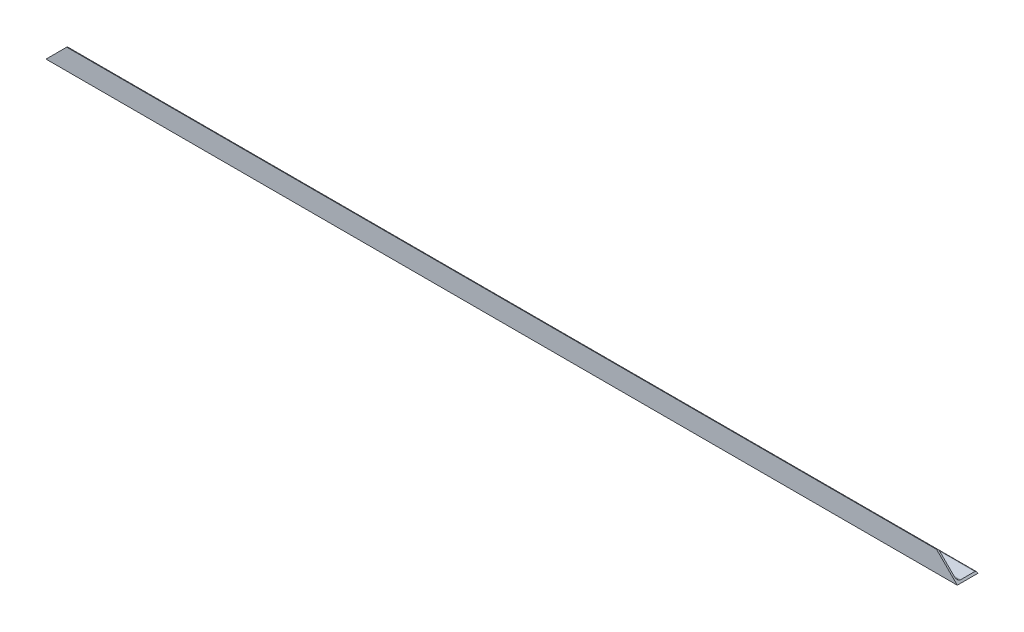
from build123d import *

# Parameters (mm, degrees)
L_ANGLE_EQUAL_40X40X3_7_DEPTH = 1760
CUT_EXTRUDE1_DEPTH            = 1761.908856244


with BuildPart() as part:
    # Sketch13 → L angle (equal) 40X40X3(7) (new body)
    with BuildSketch(Plane(origin=(0, 0, 0), x_dir=(0, 0, -1), z_dir=(1, 0, 0))):
        with BuildLine():
            Line((0, 40), (0, 0))
            Line((0, 0), (40, 0))
            ThreePointArc((40, 0), (39.121320344, 2.121320344), (37, 3))
            Line((37, 3), (9, 3))
            ThreePointArc((9, 3), (4.757359313, 4.757359313), (3, 9))
            Line((3, 9), (3, 37))
            ThreePointArc((3, 37), (2.121320344, 39.121320344), (0, 40))
        make_face()
    extrude(amount=L_ANGLE_EQUAL_40X40X3_7_DEPTH)

    # Sketch14 → Cut-Extrude1 (cut, through all)
    with BuildSketch(Plane.XY):
        Polygon((1760, 0), (1760, 40), (1720, 40), align=None)
        Polygon((0, 40), (0, 0), (40, 40), align=None)
    extrude(amount=-CUT_EXTRUDE1_DEPTH, mode=Mode.SUBTRACT)


solid = part.part
